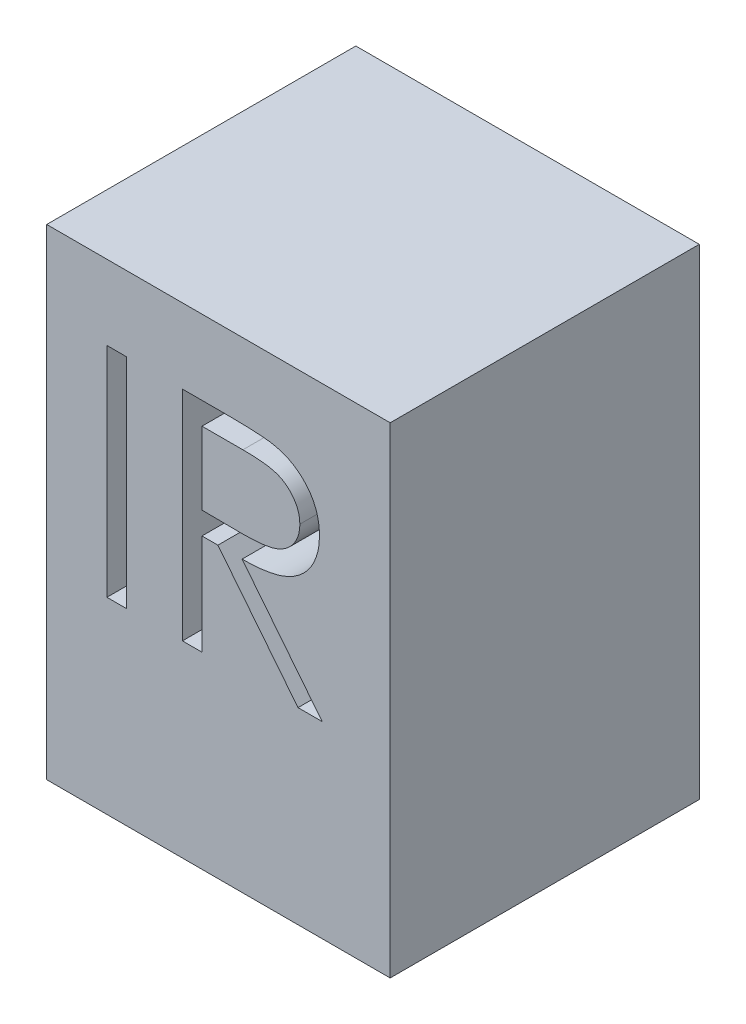
from build123d import *

# Parameters (mm, degrees)
SKETCH1_W           = 5
SKETCH1_H           = 7
BOSS_EXTRUDE1_DEPTH = 4.5
SKETCH2_W           = 0.284935897
SKETCH2_H           = 3.175
CUT_EXTRUDE1_DEPTH  = 1.27


with BuildPart() as part:
    # Sketch1 → Boss-Extrude1 (new body)
    with BuildSketch(Plane.XY):
        with Locations((2.5, 3.5)):
            Rectangle(SKETCH1_W, SKETCH1_H)
    extrude(amount=BOSS_EXTRUDE1_DEPTH)

    # Sketch2 → Cut-Extrude1 (cut)
    # profile 1 of 2: a face of its own
    with BuildSketch(Plane.XY.offset(4.5)):
        with Locations((1.019007648, 4.325358418)):
            Rectangle(SKETCH2_W, SKETCH2_H)
    # profile 2 of 2: a face of its own
    with BuildSketch(Plane.XY.offset(4.5)):
        with BuildLine():
            Line((1.97557816, 5.912858418), (2.610959771, 5.912858418))
            add(Edge.make_bspline(
                [(2.610959771, 5.912858418), (2.653360651, 5.91271728), (2.73477504, 5.912446278), (2.851409363, 5.910935193), (2.95738823, 5.90660417), (3.052656227, 5.902877098), (3.137211607, 5.896080837), (3.211313649, 5.889585107), (3.274621061, 5.881081858), (3.312944083, 5.873184795), (3.330295708, 5.86960922)],
                knots=[0, 0, 0, 0, 1.410062039, 2.707475311, 3.878576406, 4.937260626, 5.877586885, 6.699081471, 7.410979367, 8, 8, 8, 8], degree=3))
            add(Edge.make_bspline(
                [(3.330295708, 5.86960922), (3.353524574, 5.86386994), (3.399486772, 5.852513814), (3.465662903, 5.828511176), (3.528722326, 5.800734802), (3.588403095, 5.76811057), (3.644406277, 5.730396306), (3.697309316, 5.688243081), (3.747352272, 5.641881544), (3.792511322, 5.590142795), (3.835091748, 5.535862532), (3.871004287, 5.477166982), (3.90196188, 5.41578831), (3.92660942, 5.351102296), (3.946455868, 5.28373626), (3.96044967, 5.213079994), (3.968841819, 5.139455395), (3.969696217, 5.089237864), (3.970129442, 5.063774885)],
                knots=[0, 0, 0, 0, 1.027469482, 2.033020251, 3.019912614, 3.986113645, 4.951240523, 5.91722682, 6.890402269, 7.87763091, 8.8651537, 9.85103654, 10.82876324, 11.815024772, 12.821070561, 13.842952187, 14.906261191, 16, 16, 16, 16], degree=3))
            add(Edge.make_bspline(
                [(3.970129442, 5.063774885), (3.968796851, 5.021470183), (3.96619662, 4.938922752), (3.941953134, 4.819124667), (3.902241576, 4.70737436), (3.847519736, 4.603812538), (3.777833497, 4.510457881), (3.694081722, 4.428460825), (3.596217689, 4.359844619), (3.505113952, 4.312262432), (3.4246375, 4.281788865), (3.358385852, 4.260347311), (3.286116522, 4.243781099), (3.20852194, 4.228940123), (3.125279195, 4.217735371), (3.036587802, 4.209528818), (2.942384508, 4.204399788), (2.877669781, 4.203635969), (2.84437824, 4.203243034)],
                knots=[0, 0, 0, 0, 1.260483769, 2.459530307, 3.627416485, 4.787058657, 5.939039949, 7.08810263, 8.267026773, 9.491475466, 10.141966685, 10.831826277, 11.566392101, 12.351337768, 13.187381173, 14.07005841, 15.007169909, 16, 16, 16, 16], degree=3))
            Line((2.84437824, 4.203243034), (4.01083457, 2.737858418))
            Line((4.01083457, 2.737858418), (3.658480804, 2.737858418))
            Line((3.658480804, 2.737858418), (2.492024474, 4.203243034))
            Line((2.492024474, 4.203243034), (2.260514057, 4.203243034))
            Line((2.260514057, 4.203243034), (2.260514057, 2.737858418))
            Line((2.260514057, 2.737858418), (1.97557816, 2.737858418))
            Line((1.97557816, 2.737858418), (1.97557816, 5.912858418))
        make_face()
        with BuildLine():
            Line((2.260514057, 5.587217393), (2.260514057, 4.528884059))
            Line((2.260514057, 4.528884059), (2.84183417, 4.524431936))
            add(Edge.make_bspline(
                [(2.84183417, 4.524431936), (2.868975919, 4.524419928), (2.92158436, 4.524396654), (2.997694249, 4.52801958), (3.06856035, 4.532141019), (3.133911604, 4.538445068), (3.193777205, 4.546569504), (3.24812723, 4.556732211), (3.297050398, 4.568572297), (3.354108358, 4.586898057), (3.417822926, 4.615932088), (3.487066464, 4.658173648), (3.546032871, 4.711304206), (3.595851217, 4.772058698), (3.635882916, 4.838857295), (3.664105994, 4.910899287), (3.682015209, 4.986365951), (3.684127532, 5.038234663), (3.685193545, 5.064410902)],
                knots=[0, 0, 0, 0, 1.146690395, 2.22261258, 3.21895312, 4.145990853, 4.996080663, 5.770904154, 6.481378293, 7.121626537, 8.300444488, 9.431385265, 10.535395872, 11.636531494, 12.74115979, 13.810798291, 14.895190096, 16, 16, 16, 16], degree=3))
            add(Edge.make_bspline(
                [(3.685193545, 5.064410902), (3.684103049, 5.089943866), (3.681942085, 5.140540882), (3.664299273, 5.214614458), (3.634463906, 5.284525191), (3.594257304, 5.349988688), (3.545272357, 5.409411749), (3.487834055, 5.460254523), (3.423512914, 5.502209395), (3.36339547, 5.52901944), (3.309661577, 5.545456735), (3.263007528, 5.557023863), (3.210292116, 5.566317059), (3.151259379, 5.573762943), (3.086161328, 5.580162785), (3.014668809, 5.584473328), (2.937256158, 5.587025904), (2.883601442, 5.587152078), (2.855826557, 5.587217393)],
                knots=[0, 0, 0, 0, 1.101028733, 2.181837193, 3.264309656, 4.369019818, 5.486613113, 6.575447106, 7.666700264, 8.788928104, 9.402425223, 10.0903467, 10.862060571, 11.710948788, 12.657782767, 13.684531032, 14.801375019, 16, 16, 16, 16], degree=3))
            Line((2.855826557, 5.587217393), (2.260514057, 5.587217393))
        make_face(mode=Mode.SUBTRACT)
    extrude(amount=-CUT_EXTRUDE1_DEPTH, mode=Mode.SUBTRACT)


solid = part.part
